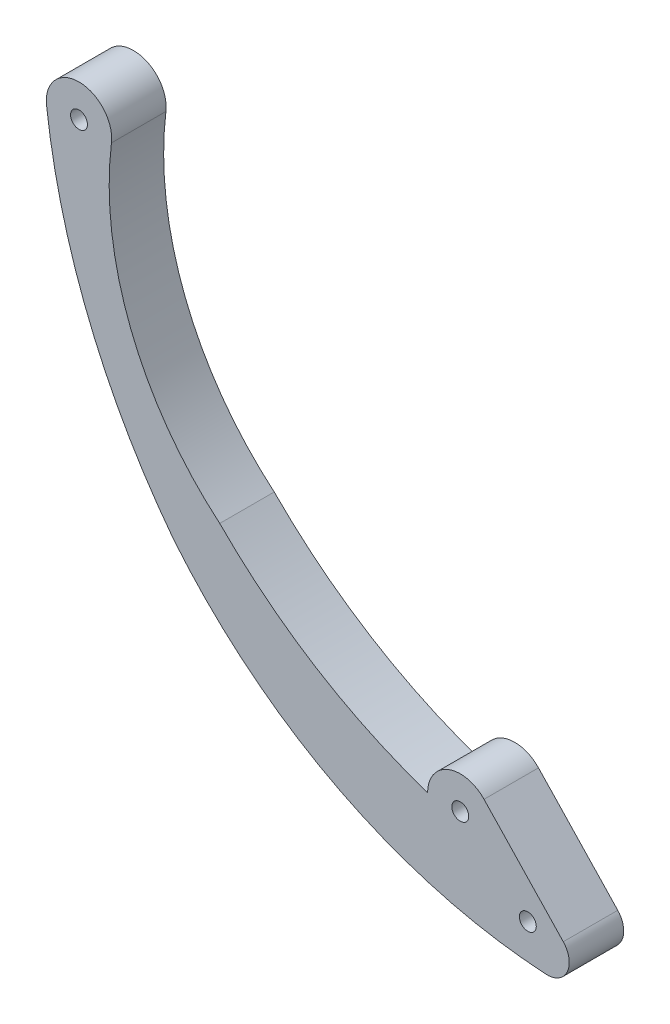
from build123d import *

# Parameters (mm, degrees)
BOSS_EXTRUDE1_DEPTH      = 5
BOSS_EXTRUDE1_DEPTH_BACK = 5
SKETCH2_R                = 1.55


with BuildPart() as part:
    # Sketch2 → Boss-Extrude1 (new, two sides: drawn at the far end of the back side and taken through both)
    with BuildSketch(Plane.XY.offset(-BOSS_EXTRUDE1_DEPTH_BACK)):
        with BuildLine():
            Line((2.905523423, 2.749169627), (-11.641714865, 18.12375444))
            ThreePointArc((-11.641714865, 18.12375444), (-18.21926668, 19.574482524), (-22, 14))
            ThreePointArc((-22, 14), (-42.474078457, 23.622085), (-60.163399658, 37.723869421))
            ThreePointArc((-60.163399658, 37.723869421), (-76.495910352, 60.486816081), (-80.043672644, 88.277390543))
            ThreePointArc((-80.043672644, 88.277390543), (-85.99568578, 94.999998449), (-91.957360362, 88.285956923))
            ThreePointArc((-91.957360362, 88.285956923), (-84.145355247, 58.049091263), (-68.630234445, 30.946019566))
            ThreePointArc((-68.630234445, 30.946019566), (-38.101001964, 6.292742427), (-0.232587209, -3.993232173))
            ThreePointArc((-0.232587209, -3.993232173), (3.626450401, -1.687855885), (2.905523423, 2.749169627))
        make_face()
        with Locations((-86, 89)):
            Circle(SKETCH2_R, mode=Mode.SUBTRACT)
        with Locations((-16, 14)):
            Circle(SKETCH2_R, mode=Mode.SUBTRACT)
        with Locations((-3.6022, 2.7054)):
            Circle(SKETCH2_R, mode=Mode.SUBTRACT)
    extrude(amount=BOSS_EXTRUDE1_DEPTH + BOSS_EXTRUDE1_DEPTH_BACK)


solid = part.part
